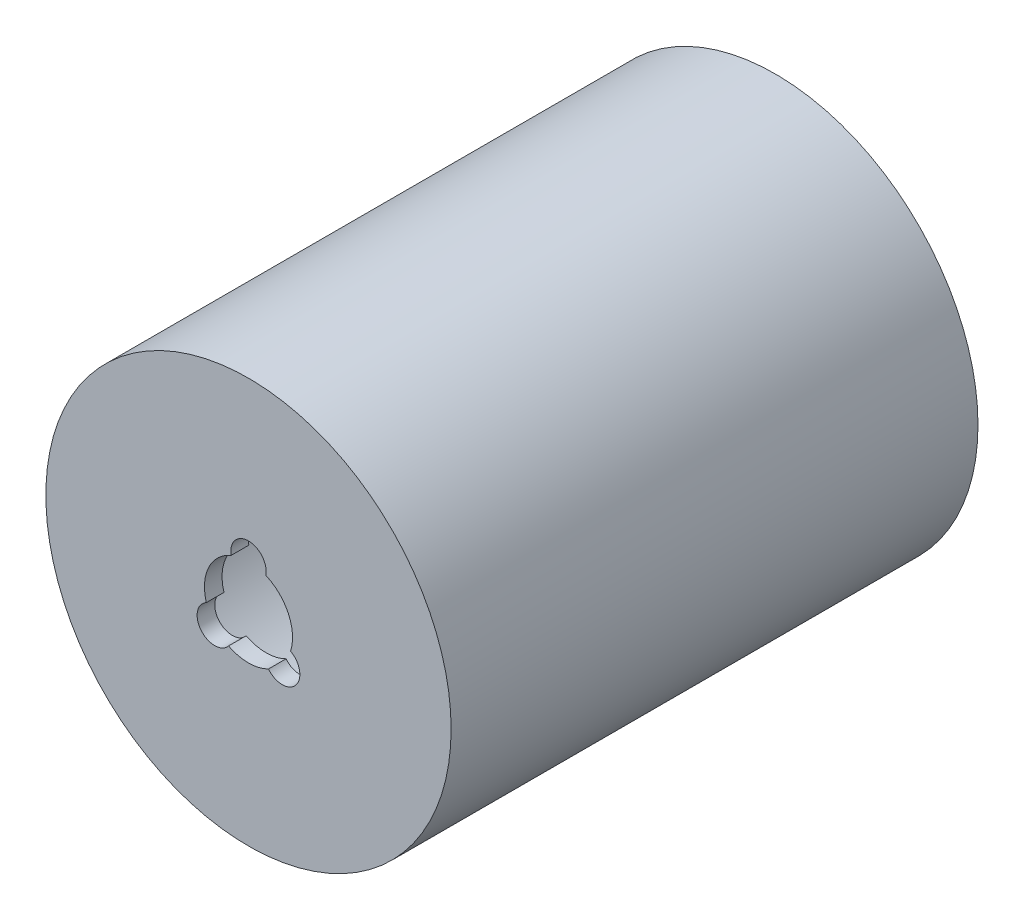
from build123d import *

# Parameters (mm, degrees)
CUT_EXTRUDE1_DEPTH = 2
CUT_EXTRUDE2_DEPTH = 1
CUT_EXTRUDE3_REACH = 70.074


with BuildPart() as part:
    # Sketch1 → Revolve1 (revolve)
    with BuildSketch(Plane(origin=(0, 0, 0), x_dir=(0, 0, -1), z_dir=(1, 0, 0))):
        Polygon((-59.8, 5), (-57.8, 5), (-57.8, 17), (-1.8, 17), (-1.8, 13), (0, 13), (0, 23), (-59.8, 23), align=None)
    revolve(axis=Axis((0, 0, 1072.381477522), (0, 0, -1)))

    # Sketch3 → Cut-Extrude1 (cut, symmetric)
    with BuildSketch(Plane.XY.offset(30.8)):
        with BuildLine():
            ThreePointArc((-6.566786752, 18.042098319), (0, -19.2), (6.566786752, 18.042098319))
            Line((6.566786752, 18.042098319), (7.592847182, 20.861176181))
            ThreePointArc((7.592847182, 20.861176181), (0, 22.2), (-7.592847182, 20.861176181))
            Line((-7.592847182, 20.861176181), (-6.566786752, 18.042098319))
        make_face()
        with BuildLine():
            add(Edge.make_bspline(
                [(-1, 19.972224976), (-1.837517439, 19.972224976), (-3.400688885, 17.606551444), (-4.505268868, 16.51808236)],
                knots=[0, 0, 0, 0, 1, 1, 1, 1], degree=3))
            Line((-1, 19.972224976), (1, 19.972224976))
            add(Edge.make_bspline(
                [(1, 19.972224976), (1.837517439, 19.972224976), (3.400688885, 17.606551444), (4.505268868, 16.51808236)],
                knots=[0, 0, 0, 0, 1, 1, 1, 1], degree=3))
            Line((4.505268868, 16.51808236), (4.683975969, 16.341981799))
            ThreePointArc((4.683975969, 16.341981799), (13.576221703, 10.231627645), (17, 0))
            ThreePointArc((17, 0), (-10.231627645, -13.576221703), (-4.683975969, 16.341981799))
            Line((-4.683975969, 16.341981799), (-4.505268868, 16.51808236))
        make_face(mode=Mode.SUBTRACT)
    extrude(amount=CUT_EXTRUDE1_DEPTH, both=True, mode=Mode.SUBTRACT)

    # Sketch3<5> → Cut-Extrude2 (cut, symmetric)
    with BuildSketch(Plane.XY.offset(30.8)):
        with BuildLine():
            Line((1, 19.972224976), (-1, 19.972224976))
            add(Edge.make_bspline(
                [(-1, 19.972224976), (-1.837517439, 19.972224976), (-3.400688885, 17.606551444), (-4.505268868, 16.51808236)],
                knots=[0, 0, 0, 0, 1, 1, 1, 1], degree=3))
            Line((-4.505268868, 16.51808236), (-4.683975969, 16.341981799))
            ThreePointArc((-4.683975969, 16.341981799), (0, -17), (4.683975969, 16.341981799))
            Line((4.683975969, 16.341981799), (4.505268868, 16.51808236))
            add(Edge.make_bspline(
                [(1, 19.972224976), (1.837517439, 19.972224976), (3.400688885, 17.606551444), (4.505268868, 16.51808236)],
                knots=[0, 0, 0, 0, 1, 1, 1, 1], degree=3))
        make_face()
        with BuildLine():
            Line((7.592847182, 20.861176181), (6.566786752, 18.042098319))
            ThreePointArc((6.566786752, 18.042098319), (0, -19.2), (-6.566786752, 18.042098319))
            Line((-6.566786752, 18.042098319), (-7.592847182, 20.861176181))
            ThreePointArc((-7.592847182, 20.861176181), (0, -22.2), (7.592847182, 20.861176181))
        make_face()
    extrude(amount=CUT_EXTRUDE2_DEPTH, both=True, mode=Mode.SUBTRACT)

    # Sketch5 → Cut-Extrude3 (cut, up to next)
    with BuildSketch(Plane.XY.offset(59.8), mode=Mode.PRIVATE) as cut_extrude3_sk1:
        with BuildLine():
            ThreePointArc((1.959591794, 4.6), (0, 7), (-1.959591794, 4.6))
            ThreePointArc((-1.959591794, 4.6), (0, 5), (1.959591794, 4.6))
        make_face()
    cut_extrude3_tool1 = extrude(cut_extrude3_sk1.sketch, amount=-CUT_EXTRUDE3_REACH, mode=Mode.PRIVATE) & part.part
    # Sketch5 → Cut-Extrude3 (cut, up to next)
    with BuildSketch(Plane.XY.offset(59.8), mode=Mode.PRIVATE) as cut_extrude3_sk2:
        with BuildLine():
            ThreePointArc((-2.264203113, -4.457957409), (-3.830222216, -3.213938048), (-4.783405764, -1.4556886))
            ThreePointArc((-4.783405764, -1.4556886), (-5.362311102, -4.499513268), (-2.264203113, -4.457957409))
        make_face()
    cut_extrude3_tool2 = extrude(cut_extrude3_sk2.sketch, amount=-CUT_EXTRUDE3_REACH, mode=Mode.PRIVATE) & part.part
    # Sketch5 → Cut-Extrude3 (cut, up to next)
    with BuildSketch(Plane.XY.offset(59.8), mode=Mode.PRIVATE) as cut_extrude3_sk3:
        with BuildLine():
            ThreePointArc((2.264203113, -4.457957409), (5.362311102, -4.499513268), (4.783405764, -1.4556886))
            ThreePointArc((4.783405764, -1.4556886), (3.830222216, -3.213938048), (2.264203113, -4.457957409))
        make_face()
    cut_extrude3_tool3 = extrude(cut_extrude3_sk3.sketch, amount=-CUT_EXTRUDE3_REACH, mode=Mode.PRIVATE) & part.part
    add(cut_extrude3_tool1.solids().sort_by_distance((0, 5.772711, 59.8))[0], mode=Mode.SUBTRACT)
    add(cut_extrude3_tool2.solids().sort_by_distance((-4.422153, -3.710627, 59.8))[0], mode=Mode.SUBTRACT)
    add(cut_extrude3_tool3.solids().sort_by_distance((4.422153, -3.710627, 59.8))[0], mode=Mode.SUBTRACT)


solid = part.part
